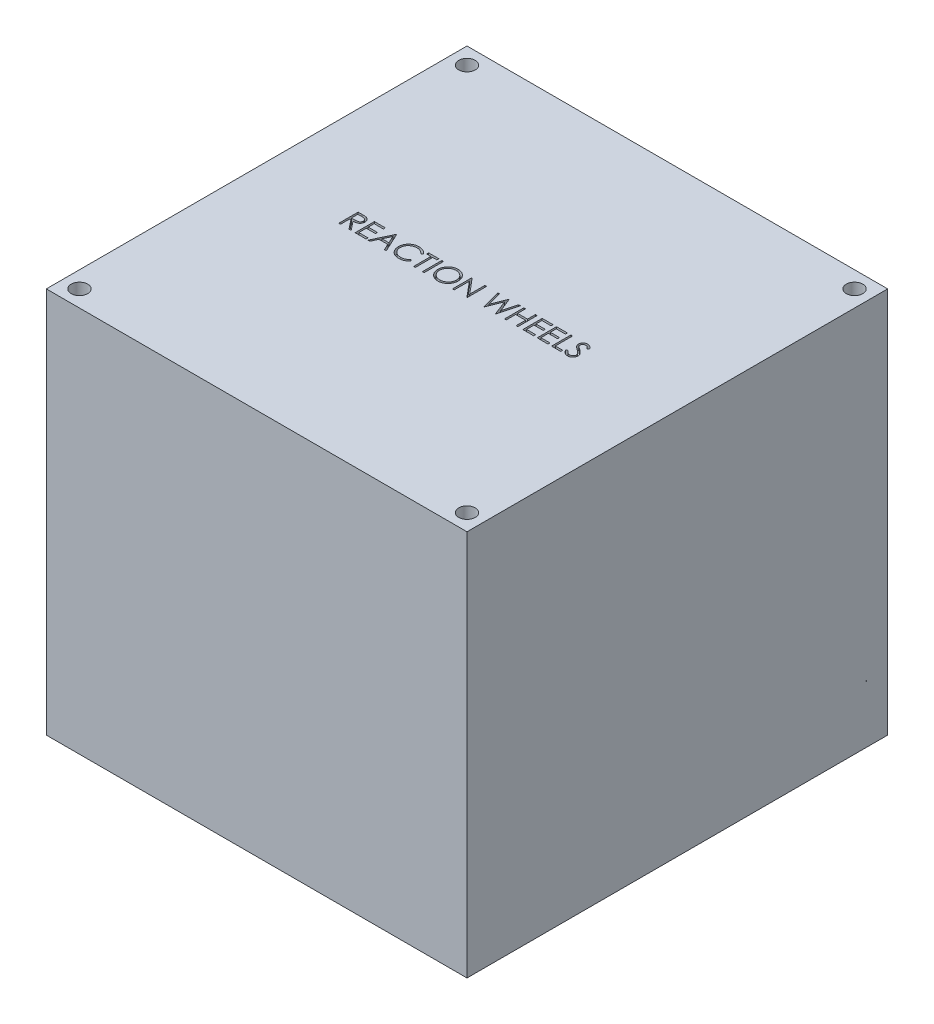
from build123d import *

# Parameters (mm, degrees)
SKETCH1_W              = 76.2
SKETCH1_H              = 76.2
BULK_DEPTH             = 70
SKETCH2_R              = 1.5
MOUNTING_HOLES_DEPTH   = 78.75
SKETCH3_W              = 0.314102564
SKETCH3_H              = 3.5
LABEL_DEPTH            = 1
SKETCH4_W              = 1.2
SKETCH4_H              = 1.2
SKETCH4_W_2            = 1
SKETCH4_H_2            = 1
ALIGNMNET_FIXING_DEPTH = 10


with BuildPart() as part:
    # Sketch1 → Bulk (new body)
    with BuildSketch(Plane(origin=(0, 0, 0), x_dir=(1, 0, 0), z_dir=(0, 1, 0))):
        Rectangle(SKETCH1_W, SKETCH1_H)
    extrude(amount=BULK_DEPTH)

    # Sketch2 → Mounting Holes (cut)
    with BuildSketch(Plane(origin=(0, 70, 0), x_dir=(1, 0, 0), z_dir=(0, 1, 0))):
        with Locations(Location((-35.1, 35.1, 0), (0, 0, 270))):
            Circle(SKETCH2_R)
        with Locations(Location((35.1, 35.1, 0), (0, 0, 270))):
            Circle(SKETCH2_R)
        with Locations(Location((35.1, -35.1, 0), (0, 0, 270))):
            Circle(SKETCH2_R)
        with Locations(Location((-35.1, -35.1, 0), (0, 0, 270))):
            Circle(SKETCH2_R)
    extrude(amount=-MOUNTING_HOLES_DEPTH, mode=Mode.SUBTRACT)

    # Sketch3 → Label (cut)
    # profile 1 of 14: a face of its own
    with BuildSketch(Plane(origin=(0, 70, 0), x_dir=(1, 0, 0), z_dir=(0, 1, 0))):
        with BuildLine():
            Line((-21.906366379, 2.178643643), (-21.205945706, 2.178643643))
            add(Edge.make_bspline(
                [(-21.205945706, 2.178643643), (-21.159204577, 2.178488057), (-21.069456433, 2.178189315), (-20.940883163, 2.176523552), (-20.824056066, 2.171749196), (-20.719036226, 2.167640612), (-20.625825571, 2.160148671), (-20.544138281, 2.152988024), (-20.474350583, 2.143614363), (-20.432104732, 2.13490894), (-20.412976956, 2.130967361)],
                knots=[0, 0, 0, 0, 1.410062039, 2.707475311, 3.878576406, 4.937260626, 5.877586885, 6.699081471, 7.410979367, 8, 8, 8, 8], degree=3))
            add(Edge.make_bspline(
                [(-20.412976956, 2.130967361), (-20.387370332, 2.124640595), (-20.336703342, 2.112122032), (-20.263753276, 2.085662431), (-20.194238952, 2.055042806), (-20.128449128, 2.019079086), (-20.066713337, 1.977504306), (-20.008395026, 1.931036184), (-19.953229563, 1.879928978), (-19.903447932, 1.822894137), (-19.856508881, 1.763057627), (-19.816920254, 1.69835387), (-19.782793774, 1.630692343), (-19.755623257, 1.559384925), (-19.733745284, 1.485123153), (-19.718319045, 1.407234356), (-19.709067857, 1.326073381), (-19.708126001, 1.270715472), (-19.70764843, 1.242646047)],
                knots=[0, 0, 0, 0, 1.027469482, 2.033020251, 3.019912614, 3.986113645, 4.951240523, 5.91722682, 6.890402269, 7.87763091, 8.8651537, 9.85103654, 10.82876324, 11.815024772, 12.821070561, 13.842952187, 14.906261191, 16, 16, 16, 16], degree=3))
            add(Edge.make_bspline(
                [(-19.70764843, 1.242646047), (-19.709117428, 1.196010942), (-19.711983824, 1.105013774), (-19.738708928, 0.972952893), (-19.782485448, 0.849763578), (-19.842808737, 0.73560094), (-19.919628212, 0.632690295), (-20.011953003, 0.54229984), (-20.119834615, 0.466659927), (-20.220263931, 0.414207122), (-20.30897813, 0.380614214), (-20.382011443, 0.356977855), (-20.461678421, 0.33871589), (-20.547215755, 0.322355758), (-20.638979411, 0.310004063), (-20.73674945, 0.300957469), (-20.840595602, 0.29530342), (-20.911934671, 0.294461415), (-20.948634007, 0.294028258)],
                knots=[0, 0, 0, 0, 1.260483769, 2.459530307, 3.627416485, 4.787058657, 5.939039949, 7.08810263, 8.267026773, 9.491475466, 10.141966685, 10.831826277, 11.566392101, 12.351337768, 13.187381173, 14.07005841, 15.007169909, 16, 16, 16, 16], degree=3))
            Line((-20.948634007, 0.294028258), (-19.662776635, -1.321356357))
            Line((-19.662776635, -1.321356357), (-20.05119811, -1.321356357))
            Line((-20.05119811, -1.321356357), (-21.337055481, 0.294028258))
            Line((-21.337055481, 0.294028258), (-21.592263815, 0.294028258))
            Line((-21.592263815, 0.294028258), (-21.592263815, -1.321356357))
            Line((-21.592263815, -1.321356357), (-21.906366379, -1.321356357))
            Line((-21.906366379, -1.321356357), (-21.906366379, 2.178643643))
        make_face()
        with BuildLine():
            Line((-21.592263815, 1.819669284), (-21.592263815, 0.653002617))
            Line((-21.592263815, 0.653002617), (-20.951438494, 0.648094765))
            add(Edge.make_bspline(
                [(-20.951438494, 0.648094765), (-20.921518455, 0.648081528), (-20.863524898, 0.648055872), (-20.779624233, 0.652049648), (-20.701504122, 0.656592966), (-20.62946337, 0.663542312), (-20.563469794, 0.672498383), (-20.503556381, 0.683701368), (-20.449625329, 0.69675343), (-20.386726791, 0.716955056), (-20.316490259, 0.748961074), (-20.2401588, 0.795526573), (-20.175156462, 0.854095692), (-20.120238599, 0.921069148), (-20.076109168, 0.994705397), (-20.044997114, 1.074121766), (-20.025254671, 1.157313364), (-20.022926126, 1.214491472), (-20.021750994, 1.243347169)],
                knots=[0, 0, 0, 0, 1.146690395, 2.22261258, 3.21895312, 4.145990853, 4.996080663, 5.770904154, 6.481378293, 7.121626537, 8.300444488, 9.431385265, 10.535395872, 11.636531494, 12.74115979, 13.810798291, 14.895190096, 16, 16, 16, 16], degree=3))
            add(Edge.make_bspline(
                [(-20.021750994, 1.243347169), (-20.022953115, 1.271493742), (-20.025335281, 1.327269981), (-20.044784049, 1.408925891), (-20.077673431, 1.485992841), (-20.121995669, 1.558157326), (-20.175994824, 1.623663062), (-20.239312636, 1.679710215), (-20.310217831, 1.72595968), (-20.37648903, 1.75551406), (-20.435723242, 1.773633914), (-20.487152902, 1.786385078), (-20.54526438, 1.796629546), (-20.610339839, 1.804837607), (-20.682101469, 1.811892552), (-20.76091212, 1.81664433), (-20.846248901, 1.819458194), (-20.905395832, 1.819597283), (-20.936013815, 1.819669284)],
                knots=[0, 0, 0, 0, 1.101028733, 2.181837193, 3.264309656, 4.369019818, 5.486613113, 6.575447106, 7.666700264, 8.788928104, 9.402425223, 10.0903467, 10.862060571, 11.710948788, 12.657782767, 13.684531032, 14.801375019, 16, 16, 16, 16], degree=3))
            Line((-20.936013815, 1.819669284), (-21.592263815, 1.819669284))
        make_face(mode=Mode.SUBTRACT)
    # profile 2 of 14: a face of its own
    with BuildSketch(Plane(origin=(0, 70, 0), x_dir=(1, 0, 0), z_dir=(0, 1, 0))):
        Polygon((-18.944827917, 2.178643643), (-16.970468943, 2.178643643), (-16.970468943, 1.819669284), (-18.630725353, 1.819669284), (-18.630725353, 0.742746207), (-16.970468943, 0.742746207), (-16.970468943, 0.383771848), (-18.630725353, 0.383771848), (-18.630725353, -0.962381998), (-16.970468943, -0.962381998), (-16.970468943, -1.321356357), (-18.944827917, -1.321356357), align=None)
    # profile 3 of 14: a face of its own
    with BuildSketch(Plane(origin=(0, 70, 0), x_dir=(1, 0, 0), z_dir=(0, 1, 0))):
        Polygon((-14.906366379, 2.178643643), (-13.290981764, -1.321356357), (-13.632428078, -1.321356357), (-14.149855962, -0.199561485), (-15.736494584, -0.199561485), (-16.268646026, -1.321356357), (-16.611494584, -1.321356357), (-14.951238174, 2.178643643), align=None)
        Polygon((-14.932307885, 1.496452136), (-15.566121988, 0.159412874), (-14.315320706, 0.159412874), align=None, mode=Mode.SUBTRACT)
    # profile 4 of 14: a face of its own
    with BuildSketch(Plane(origin=(0, 70, 0), x_dir=(1, 0, 0), z_dir=(0, 1, 0))):
        with BuildLine():
            Line((-9.432007405, 1.536416079), (-9.706847148, 1.32607954))
            add(Edge.make_bspline(
                [(-9.706847148, 1.32607954), (-9.726453037, 1.34944551), (-9.765400483, 1.395862426), (-9.828059686, 1.46104197), (-9.893361329, 1.522107232), (-9.96128045, 1.579349111), (-10.033039569, 1.630765877), (-10.106900368, 1.67903698), (-10.184098413, 1.722304718), (-10.290850148, 1.774767704), (-10.430497996, 1.829513859), (-10.606292835, 1.87541709), (-10.789803934, 1.904638266), (-10.915001533, 1.907803108), (-10.978682084, 1.909412874)],
                knots=[0, 0, 0, 0, 0.757959112, 1.505699292, 2.245454638, 2.979532153, 3.711538275, 4.438200793, 5.171680507, 5.909471876, 7.393775596, 8.890124382, 10.418191784, 12, 12, 12, 12], degree=3))
            add(Edge.make_bspline(
                [(-10.978682084, 1.909412874), (-11.013765383, 1.909008911), (-11.083606376, 1.908204735), (-11.187254849, 1.89759561), (-11.288967901, 1.8826844), (-11.388679367, 1.860559077), (-11.486262325, 1.832586458), (-11.582354727, 1.799161044), (-11.675565327, 1.757806204), (-11.767183565, 1.712097944), (-11.854962776, 1.660470499), (-11.938017824, 1.604157147), (-12.016045792, 1.543788051), (-12.089108404, 1.479136945), (-12.157280353, 1.410494984), (-12.220067663, 1.337130642), (-12.277253074, 1.259278469), (-12.329970099, 1.177965061), (-12.377182832, 1.09342727), (-12.416712711, 1.005352199), (-12.451717834, 0.915248096), (-12.479417076, 0.822096935), (-12.501341593, 0.72655417), (-12.516469256, 0.628363382), (-12.526957728, 0.527729702), (-12.527757905, 0.459520389), (-12.528161251, 0.425138034)],
                knots=[0, 0, 0, 0, 1.054917814, 2.100044995, 3.131103042, 4.146048494, 5.169673617, 6.183595914, 7.203665975, 8.234915748, 9.262203917, 10.264457458, 11.251630812, 12.227803204, 13.197192746, 14.159520551, 15.12972552, 16.100847026, 17.073214652, 18.039054194, 19.002613845, 19.979014051, 20.95965708, 21.949030935, 22.966165397, 24, 24, 24, 24], degree=3))
            add(Edge.make_bspline(
                [(-12.528161251, 0.425138034), (-12.526899432, 0.373406714), (-12.524422017, 0.271839129), (-12.502373683, 0.123068519), (-12.468868592, -0.019452155), (-12.418653015, -0.154831997), (-12.356733965, -0.284740356), (-12.278493353, -0.406979209), (-12.187876816, -0.523395773), (-12.083602396, -0.631238721), (-11.96919658, -0.729752447), (-11.846448669, -0.816503028), (-11.715664381, -0.88881791), (-11.578287751, -0.948993857), (-11.433261637, -0.995250585), (-11.280846834, -1.027814708), (-11.121374839, -1.049056889), (-11.012405439, -1.051090577), (-10.956947308, -1.052125588)],
                knots=[0, 0, 0, 0, 1.029171465, 2.020641659, 2.987623507, 3.938342917, 4.889210282, 5.84687017, 6.821220943, 7.821438502, 8.827599549, 9.822697543, 10.807740252, 11.797342354, 12.80366471, 13.83203677, 14.896651826, 16, 16, 16, 16], degree=3))
            add(Edge.make_bspline(
                [(-10.956947308, -1.052125588), (-10.895844619, -1.050436808), (-10.77557991, -1.047112886), (-10.599211884, -1.018953636), (-10.430376119, -0.973295719), (-10.269063532, -0.909397796), (-10.115728886, -0.826332508), (-9.970132225, -0.725634631), (-9.832150655, -0.606346298), (-9.749179373, -0.51526317), (-9.706847148, -0.468792255)],
                knots=[0, 0, 0, 0, 1.028121516, 2.023589091, 2.998037872, 3.967518031, 4.937445131, 5.927275754, 6.942489185, 8, 8, 8, 8], degree=3))
            Line((-9.706847148, -0.468792255), (-9.432007405, -0.677025428))
            add(Edge.make_bspline(
                [(-9.432007405, -0.677025428), (-9.454125514, -0.70556388), (-9.49825579, -0.762504086), (-9.569713807, -0.842775796), (-9.644991104, -0.918279831), (-9.724646814, -0.988407452), (-9.807764606, -1.054561918), (-9.895836918, -1.114863749), (-9.987705951, -1.170154633), (-10.083060429, -1.220781558), (-10.181799042, -1.265698805), (-10.283803477, -1.304152573), (-10.388634053, -1.337277462), (-10.496295561, -1.364529399), (-10.607011318, -1.385800483), (-10.720381792, -1.400020158), (-10.836651667, -1.409762072), (-10.915093088, -1.410649988), (-10.954843943, -1.411099947)],
                knots=[0, 0, 0, 0, 0.986787822, 1.968848986, 2.935600012, 3.899624008, 4.868462664, 5.837806735, 6.815139263, 7.798259679, 8.787526145, 9.778297419, 10.776456485, 11.791383307, 12.812564526, 13.85620153, 14.913611965, 16, 16, 16, 16], degree=3))
            add(Edge.make_bspline(
                [(-10.954843943, -1.411099947), (-10.99248761, -1.410837954), (-11.0669233, -1.410319896), (-11.176822052, -1.401927729), (-11.283811633, -1.390477992), (-11.387586258, -1.373237861), (-11.488712234, -1.352893521), (-11.586272818, -1.325622264), (-11.681228028, -1.295073098), (-11.773196369, -1.259168111), (-11.862256069, -1.218651929), (-11.94811988, -1.17286037), (-12.030748313, -1.122178505), (-12.110953733, -1.067723495), (-12.187551317, -1.007746193), (-12.261204842, -0.943079558), (-12.332327319, -0.873941547), (-12.376330004, -0.824086694), (-12.398453719, -0.79902062)],
                knots=[0, 0, 0, 0, 1.114604814, 2.203992996, 3.262667896, 4.300477797, 5.318619304, 6.316056647, 7.298880507, 8.271930387, 9.238335007, 10.195173496, 11.151986948, 12.108099108, 13.064862484, 14.031167946, 15.010108607, 16, 16, 16, 16], degree=3))
            add(Edge.make_bspline(
                [(-12.398453719, -0.79902062), (-12.433889362, -0.755479431), (-12.504332839, -0.668922721), (-12.594458523, -0.528636739), (-12.671606078, -0.38216853), (-12.733981999, -0.228748602), (-12.782744732, -0.068721214), (-12.816525927, 0.0979943), (-12.838477531, 0.271242242), (-12.84098782, 0.389079031), (-12.842263815, 0.448976175)],
                knots=[0, 0, 0, 0, 0.994628077, 1.977248131, 2.950237994, 3.925870899, 4.908910175, 5.911660606, 6.938484602, 8, 8, 8, 8], degree=3))
            add(Edge.make_bspline(
                [(-12.842263815, 0.448976175), (-12.840708621, 0.511931628), (-12.837648875, 0.635792553), (-12.81165308, 0.817566506), (-12.769834283, 0.991717905), (-12.710437395, 1.15792165), (-12.635132043, 1.31705193), (-12.54210543, 1.467893135), (-12.432438287, 1.611409935), (-12.30699072, 1.745424686), (-12.169423384, 1.867964038), (-12.022104571, 1.975770242), (-11.865322624, 2.065487758), (-11.700804772, 2.140483921), (-11.52731909, 2.198128384), (-11.345235721, 2.23848157), (-11.154896806, 2.263598687), (-11.025034381, 2.266773895), (-10.959050674, 2.268387233)],
                knots=[0, 0, 0, 0, 1.032925535, 2.032216505, 3.007276963, 3.968222605, 4.92396291, 5.891752235, 6.871517503, 7.883894988, 8.900124299, 9.891468569, 10.874487609, 11.85992873, 12.854644235, 13.869047385, 14.917252991, 16, 16, 16, 16], degree=3))
            add(Edge.make_bspline(
                [(-10.959050674, 2.268387233), (-10.918836202, 2.267905094), (-10.839235705, 2.26695075), (-10.721483052, 2.257644608), (-10.606840725, 2.242131002), (-10.495229743, 2.221014932), (-10.386107127, 2.194807611), (-10.280306886, 2.160667313), (-10.177208199, 2.121630781), (-10.077461291, 2.076672315), (-9.981544741, 2.026205574), (-9.889488422, 1.97078995), (-9.802023564, 1.910494145), (-9.718534715, 1.845830969), (-9.640418504, 1.77543241), (-9.565457026, 1.701234814), (-9.496195947, 1.62110099), (-9.453442752, 1.564696056), (-9.432007405, 1.536416079)],
                knots=[0, 0, 0, 0, 1.096760587, 2.17092713, 3.219439832, 4.250915756, 5.268269357, 6.278326846, 7.281116186, 8.274029601, 9.260640565, 10.235837813, 11.203064059, 12.156899882, 13.114053108, 14.069676657, 15.032185724, 16, 16, 16, 16], degree=3))
        make_face()
    # profile 5 of 14: a face of its own
    with BuildSketch(Plane(origin=(0, 70, 0), x_dir=(1, 0, 0), z_dir=(0, 1, 0))):
        Polygon((-9.11790484, 1.819669284), (-9.11790484, 2.178643643), (-7.278161251, 2.178643643), (-7.278161251, 1.819669284), (-8.040981764, 1.819669284), (-8.040981764, -1.321356357), (-8.355084328, -1.321356357), (-8.355084328, 1.819669284), align=None)
    # profile 6 of 14: a face of its own
    with BuildSketch(Plane(origin=(0, 70, 0), x_dir=(1, 0, 0), z_dir=(0, 1, 0))):
        with Locations((-6.58264843, 0.428643643)):
            Rectangle(SKETCH3_W, SKETCH3_H)
    # profile 7 of 14: a face of its own
    with BuildSketch(Plane(origin=(0, 70, 0), x_dir=(1, 0, 0), z_dir=(0, 1, 0))):
        with BuildLine():
            add(Edge.make_bspline(
                [(-3.890340738, 2.268387233), (-3.825532632, 2.266745753), (-3.698244165, 2.263521752), (-3.511169267, 2.238842649), (-3.332574172, 2.196147259), (-3.161004033, 2.139284276), (-2.998511057, 2.063429891), (-2.843872164, 1.971744743), (-2.69745529, 1.863268284), (-2.561233909, 1.738839057), (-2.436576959, 1.603455603), (-2.326751072, 1.458977693), (-2.234708779, 1.306278891), (-2.159122991, 1.14581806), (-2.099824382, 0.977958092), (-2.058905338, 0.801804089), (-2.032767188, 0.618497399), (-2.02971141, 0.493470535), (-2.028161251, 0.430045886)],
                knots=[0, 0, 0, 0, 1.065120563, 2.091984664, 3.0946048, 4.079830382, 5.057816894, 6.036188127, 7.030412546, 8.04752943, 9.064399622, 10.05169764, 11.02544977, 11.989514704, 12.962713494, 13.945757189, 14.957906945, 16, 16, 16, 16], degree=3))
            add(Edge.make_bspline(
                [(-2.028161251, 0.430045886), (-2.029711183, 0.36708844), (-2.03276628, 0.24299202), (-2.058935057, 0.060848576), (-2.099976057, -0.114242121), (-2.158572324, -0.281987774), (-2.233797802, -0.442565338), (-2.326452973, -0.595552291), (-2.435594184, -0.74099879), (-2.559801035, -0.877311455), (-2.695202077, -1.002308926), (-2.840432344, -1.111227801), (-2.992225664, -1.204951926), (-3.152535372, -1.2797356), (-3.319235409, -1.33950752), (-3.493817732, -1.38026015), (-3.675464286, -1.406547194), (-3.79933529, -1.40956571), (-3.862295866, -1.411099947)],
                knots=[0, 0, 0, 0, 1.043624062, 2.057103931, 3.04512605, 4.022047818, 4.998200453, 5.980619268, 6.982898556, 8.009068085, 9.034988726, 10.034168286, 11.015286542, 11.987931943, 12.962482838, 13.94673481, 14.956375938, 16, 16, 16, 16], degree=3))
            add(Edge.make_bspline(
                [(-3.862295866, -1.411099947), (-3.925720185, -1.40955056), (-4.050746401, -1.406496306), (-4.234283436, -1.380314901), (-4.41056118, -1.339373597), (-4.579075531, -1.280864161), (-4.739920461, -1.205246931), (-4.893410544, -1.113042551), (-5.038929691, -1.00363541), (-5.175271437, -0.879468836), (-5.300020636, -0.744297284), (-5.408780011, -0.599463029), (-5.501005125, -0.447807572), (-5.576368457, -0.288910048), (-5.636032917, -0.123538605), (-5.676737735, 0.049409872), (-5.703073687, 0.228949378), (-5.706108533, 0.351192276), (-5.70764843, 0.413218963)],
                knots=[0, 0, 0, 0, 1.053102029, 2.075944431, 3.073151272, 4.055350789, 5.033113405, 6.020478099, 7.024410459, 8.052272461, 9.079885166, 10.07527673, 11.055994387, 12.023226415, 12.992069828, 13.970394897, 14.97016774, 16, 16, 16, 16], degree=3))
            add(Edge.make_bspline(
                [(-5.70764843, 0.413218963), (-5.707113795, 0.454851633), (-5.706051268, 0.537591756), (-5.693259576, 0.660458356), (-5.674697875, 0.781349014), (-5.648095962, 0.899919962), (-5.613304295, 1.015880947), (-5.572252268, 1.130031709), (-5.522112422, 1.241215433), (-5.465431774, 1.349958825), (-5.402169966, 1.454566731), (-5.332294217, 1.553446314), (-5.258258848, 1.647427311), (-5.177095455, 1.734074315), (-5.09147901, 1.815907971), (-5.000020631, 1.891670688), (-4.903278387, 1.962045639), (-4.800836007, 2.02546598), (-4.695217732, 2.082825115), (-4.586340955, 2.132046966), (-4.475684383, 2.174293027), (-4.362729735, 2.208533852), (-4.247776963, 2.235565888), (-4.130575179, 2.253973242), (-4.011217752, 2.26679756), (-3.930806433, 2.267855062), (-3.890340738, 2.268387233)],
                knots=[0, 0, 0, 0, 1.037015668, 2.060948919, 3.074880161, 4.083647147, 5.086022904, 6.090072063, 7.104153813, 8.122640571, 9.144368836, 10.147691507, 11.138137339, 12.123020368, 13.103399296, 14.087645067, 15.080126199, 16.082011238, 17.087798457, 18.072939717, 19.057185487, 20.037253025, 21.01195951, 21.997135196, 22.992090687, 24, 24, 24, 24], degree=3))
        make_face()
        with BuildLine():
            add(Edge.make_bspline(
                [(-3.874916058, 1.909412874), (-3.908130692, 1.909007983), (-3.974242425, 1.908202074), (-4.072526961, 1.897586358), (-4.169518895, 1.882456469), (-4.265238257, 1.860874948), (-4.359284547, 1.831470896), (-4.452534388, 1.797629987), (-4.544137442, 1.756408897), (-4.633791299, 1.709836192), (-4.720706375, 1.658287272), (-4.802719076, 1.601315505), (-4.88004172, 1.54025695), (-4.952484987, 1.474969113), (-5.019836159, 1.405119511), (-5.08342086, 1.331767075), (-5.140690442, 1.252815184), (-5.193176019, 1.170404777), (-5.240143859, 1.084643196), (-5.281909214, 0.996433334), (-5.316073223, 0.905055647), (-5.343935599, 0.811501489), (-5.36703541, 0.71591903), (-5.381669334, 0.617583181), (-5.392401693, 0.516988069), (-5.393161539, 0.449006215), (-5.393545866, 0.414621207)],
                knots=[0, 0, 0, 0, 1.008559885, 2.007477868, 2.99961109, 3.989939068, 4.984837346, 5.991145699, 7.001802488, 8.033829008, 9.059044045, 10.069351652, 11.065060232, 12.050310815, 13.029377138, 14.011219647, 14.996725999, 15.989392538, 16.977580475, 17.965360261, 18.951710183, 19.937753436, 20.929683414, 21.935841486, 22.955955122, 24, 24, 24, 24], degree=3))
            add(Edge.make_bspline(
                [(-5.393545866, 0.414621207), (-5.392271004, 0.364058986), (-5.389762956, 0.264587456), (-5.367805386, 0.118819312), (-5.333983412, -0.021268974), (-5.284126045, -0.154910884), (-5.221775431, -0.283255166), (-5.14474854, -0.405163271), (-5.053489455, -0.520668145), (-4.949825928, -0.628963414), (-4.836503222, -0.727809219), (-4.716170492, -0.814572627), (-4.590116884, -0.887982877), (-4.458013681, -0.94778795), (-4.320566142, -0.995177687), (-4.176888591, -1.027656318), (-4.027938132, -1.049031774), (-3.926407477, -1.05108453), (-3.874916058, -1.052125588)],
                knots=[0, 0, 0, 0, 1.032063989, 2.030389145, 3.003944642, 3.970395727, 4.937377036, 5.913328081, 6.909231446, 7.93887556, 8.970685674, 9.976071282, 10.964166581, 11.944589148, 12.933237628, 13.927779006, 14.949070134, 16, 16, 16, 16], degree=3))
            add(Edge.make_bspline(
                [(-3.874916058, -1.052125588), (-3.840306557, -1.051650084), (-3.77166552, -1.050707016), (-3.669569998, -1.041208339), (-3.569313786, -1.025976469), (-3.471037506, -1.004045814), (-3.374852695, -0.976598607), (-3.280357892, -0.943990879), (-3.188559602, -0.903309676), (-3.098299764, -0.858361724), (-3.011903522, -0.807121567), (-2.92942799, -0.752083417), (-2.85295201, -0.691114796), (-2.780562939, -0.626796984), (-2.71293525, -0.557833136), (-2.650526265, -0.484312914), (-2.593546133, -0.405772257), (-2.541080487, -0.323486851), (-2.494277224, -0.237490598), (-2.453498125, -0.14896092), (-2.418902009, -0.058115811), (-2.390973504, 0.035175761), (-2.369088042, 0.130736609), (-2.354008123, 0.228694688), (-2.343459684, 0.32885403), (-2.342664607, 0.396597886), (-2.342263815, 0.430747008)],
                knots=[0, 0, 0, 0, 1.047197238, 2.076906641, 3.100256066, 4.114471768, 5.12198147, 6.126382909, 7.136867548, 8.15857795, 9.17633901, 10.174870724, 11.156907918, 12.133735059, 13.104061851, 14.077631395, 15.04955518, 16.038496417, 17.029181396, 18.010275684, 18.986308667, 19.968651475, 20.955262928, 21.950658345, 22.966943676, 24, 24, 24, 24], degree=3))
            add(Edge.make_bspline(
                [(-2.342263815, 0.430747008), (-2.342664928, 0.464662513), (-2.343460609, 0.531940163), (-2.354003084, 0.631400981), (-2.369103974, 0.728654193), (-2.390866682, 0.823317996), (-2.418916836, 0.915416521), (-2.453504166, 1.004863268), (-2.494289466, 1.091991463), (-2.54109769, 1.17658576), (-2.593713514, 1.257760498), (-2.651207757, 1.335362911), (-2.714573105, 1.407935652), (-2.78199913, 1.477270346), (-2.855170015, 1.541888236), (-2.93375431, 1.601810757), (-3.016797987, 1.658484031), (-3.104725223, 1.709609593), (-3.195469176, 1.756823825), (-3.288583134, 1.797274829), (-3.383012234, 1.831646948), (-3.478516346, 1.860963913), (-3.575899325, 1.882371943), (-3.674503154, 1.897599993), (-3.774191412, 1.908198379), (-3.841234632, 1.909006757), (-3.874916058, 1.909412874)],
                knots=[0, 0, 0, 0, 1.02996197, 2.043119294, 3.035359645, 4.018872909, 4.991431989, 5.957985074, 6.929999688, 7.912076566, 8.892894881, 9.867085534, 10.843653904, 11.817741046, 12.803660682, 13.806313499, 14.818574707, 15.856120519, 16.894564902, 17.924820532, 18.937903209, 19.946497019, 20.957711757, 21.963978472, 22.977135795, 24, 24, 24, 24], degree=3))
        make_face(mode=Mode.SUBTRACT)
    # profile 8 of 14: a face of its own
    with BuildSketch(Plane(origin=(0, 70, 0), x_dir=(1, 0, 0), z_dir=(0, 1, 0))):
        Polygon((-1.310212533, -1.321356357), (-1.310212533, 2.178643643), (-1.244307084, 2.178643643), (1.067992595, -0.576063889), (1.067992595, 2.178643643), (1.38209516, 2.178643643), (1.38209516, -1.321356357), (1.310580736, -1.321356357), (-0.996109969, 1.427041079), (-0.996109969, -1.321356357), align=None)
    # profile 9 of 14: a face of its own
    with BuildSketch(Plane(origin=(0, 70, 0), x_dir=(1, 0, 0), z_dir=(0, 1, 0))):
        Polygon((3.401325929, 2.178643643), (3.72594532, 2.178643643), (4.410941313, -0.388163248), (5.429671281, 2.178643643), (5.475244198, 2.178643643), (6.475043877, -0.370635203), (7.16354548, 2.178643643), (7.484659262, 2.178643643), (6.540949326, -1.321356357), (6.496077531, -1.321356357), (5.442992595, 1.355526656), (4.377287467, -1.321356357), (4.332415672, -1.321356357), align=None)
    # profile 10 of 14: a face of its own
    with BuildSketch(Plane(origin=(0, 70, 0), x_dir=(1, 0, 0), z_dir=(0, 1, 0))):
        Polygon((8.11286439, 2.178643643), (8.426966954, 2.178643643), (8.426966954, 0.742746207), (10.221838749, 0.742746207), (10.221838749, 2.178643643), (10.535941313, 2.178643643), (10.535941313, -1.321356357), (10.221838749, -1.321356357), (10.221838749, 0.383771848), (8.426966954, 0.383771848), (8.426966954, -1.321356357), (8.11286439, -1.321356357), align=None)
    # profile 11 of 14: a face of its own
    with BuildSketch(Plane(origin=(0, 70, 0), x_dir=(1, 0, 0), z_dir=(0, 1, 0))):
        Polygon((11.433377211, 2.178643643), (13.407736185, 2.178643643), (13.407736185, 1.819669284), (11.747479775, 1.819669284), (11.747479775, 0.742746207), (13.407736185, 0.742746207), (13.407736185, 0.383771848), (11.747479775, 0.383771848), (11.747479775, -0.962381998), (13.407736185, -0.962381998), (13.407736185, -1.321356357), (11.433377211, -1.321356357), align=None)
    # profile 12 of 14: a face of its own
    with BuildSketch(Plane(origin=(0, 70, 0), x_dir=(1, 0, 0), z_dir=(0, 1, 0))):
        Polygon((14.035941313, 2.178643643), (16.010300288, 2.178643643), (16.010300288, 1.819669284), (14.350043877, 1.819669284), (14.350043877, 0.742746207), (16.010300288, 0.742746207), (16.010300288, 0.383771848), (14.350043877, 0.383771848), (14.350043877, -0.962381998), (16.010300288, -0.962381998), (16.010300288, -1.321356357), (14.035941313, -1.321356357), align=None)
    # profile 13 of 14: a face of its own
    with BuildSketch(Plane(origin=(0, 70, 0), x_dir=(1, 0, 0), z_dir=(0, 1, 0))):
        Polygon((16.638505416, 2.178643643), (16.95260798, 2.178643643), (16.95260798, -0.962381998), (18.298761826, -0.962381998), (18.298761826, -1.321356357), (16.638505416, -1.321356357), align=None)
    # profile 14 of 14: a face of its own
    with BuildSketch(Plane(origin=(0, 70, 0), x_dir=(1, 0, 0), z_dir=(0, 1, 0))):
        with BuildLine():
            Line((18.523120801, -0.646176069), (18.818994198, -0.468792255))
            add(Edge.make_bspline(
                [(18.818994198, -0.468792255), (18.846512435, -0.514856639), (18.899236316, -0.603114223), (18.987187675, -0.722372264), (19.078320586, -0.823734421), (19.17330992, -0.906611028), (19.271575868, -0.971859915), (19.373759922, -1.018062147), (19.479517732, -1.046878122), (19.551491554, -1.050378209), (19.587423685, -1.052125588)],
                knots=[0, 0, 0, 0, 1.272034388, 2.437168799, 3.508375237, 4.49857839, 5.41946034, 6.295179144, 7.148887113, 8, 8, 8, 8], degree=3))
            add(Edge.make_bspline(
                [(19.587423685, -1.052125588), (19.618110546, -1.051270915), (19.678947319, -1.049576525), (19.768509562, -1.033295723), (19.855491364, -1.008283594), (19.938100002, -0.972462663), (20.015195616, -0.929124177), (20.082802312, -0.876777999), (20.141248425, -0.818171794), (20.189057539, -0.752789139), (20.225737575, -0.68247199), (20.253929643, -0.610296039), (20.269574717, -0.535127471), (20.27193147, -0.484517008), (20.273120801, -0.458976549)],
                knots=[0, 0, 0, 0, 1.095163259, 2.171163733, 3.241058638, 4.321873601, 5.38011039, 6.391990106, 7.366004449, 8.327778327, 9.272591725, 10.192022065, 11.087607919, 12, 12, 12, 12], degree=3))
            add(Edge.make_bspline(
                [(20.273120801, -0.458976549), (20.27164649, -0.4298357), (20.268649432, -0.370596611), (20.243317952, -0.283196958), (20.203468705, -0.196704388), (20.166706061, -0.143203122), (20.147619999, -0.11542687)],
                knots=[0, 0, 0, 0, 0.938893495, 1.908633276, 2.914225137, 4, 4, 4, 4], degree=3))
            add(Edge.make_bspline(
                [(20.147619999, -0.11542687), (20.131949385, -0.095380046), (20.099050891, -0.053294248), (20.042493378, 0.009350988), (19.976127264, 0.073969407), (19.902223709, 0.143028464), (19.81809062, 0.21331626), (19.726363106, 0.288184538), (19.624699247, 0.364786115), (19.55339975, 0.416158681), (19.516610384, 0.442666079)],
                knots=[0, 0, 0, 0, 0.722233717, 1.516239348, 2.393582979, 3.351407094, 4.387010283, 5.505090956, 6.712668013, 8, 8, 8, 8], degree=3))
            add(Edge.make_bspline(
                [(19.516610384, 0.442666079), (19.479786388, 0.468894666), (19.409381711, 0.519041729), (19.310923129, 0.593466013), (19.222878666, 0.661509882), (19.145639649, 0.723813894), (19.079240052, 0.780386499), (19.023156641, 0.830684438), (18.978818084, 0.876067999), (18.954162504, 0.905509341), (18.943092756, 0.918727777)],
                knots=[0, 0, 0, 0, 1.452282411, 2.77665338, 3.964542531, 5.026858415, 5.96415736, 6.766646006, 7.446254459, 8, 8, 8, 8], degree=3))
            add(Edge.make_bspline(
                [(18.943092756, 0.918727777), (18.92762021, 0.939328814), (18.897191374, 0.979843518), (18.857025368, 1.043168376), (18.822886205, 1.107991641), (18.796123873, 1.174487506), (18.773587655, 1.241722435), (18.758429724, 1.31057368), (18.748938327, 1.380732299), (18.74796634, 1.4279458), (18.747479775, 1.451580342)],
                knots=[0, 0, 0, 0, 1.068054152, 2.10047183, 3.106115577, 4.101338837, 5.06977816, 6.043150881, 7.020423561, 8, 8, 8, 8], degree=3))
            add(Edge.make_bspline(
                [(18.747479775, 1.451580342), (18.748784984, 1.488610116), (18.751367504, 1.56187818), (18.773208021, 1.66890901), (18.807680915, 1.771095428), (18.855975803, 1.867425761), (18.918233156, 1.955391742), (18.99027913, 2.036005229), (19.076090616, 2.103773811), (19.17024324, 2.16298587), (19.273299612, 2.209331795), (19.381290515, 2.244292775), (19.494387587, 2.264102033), (19.570990722, 2.266944798), (19.609859583, 2.268387233)],
                knots=[0, 0, 0, 0, 1.005424448, 1.989358655, 2.955360095, 3.929531133, 4.905563448, 5.876582895, 6.856512386, 7.866279853, 8.892233794, 9.918561126, 10.94386622, 12, 12, 12, 12], degree=3))
            add(Edge.make_bspline(
                [(19.609859583, 2.268387233), (19.651103683, 2.266964681), (19.733125035, 2.26413568), (19.85377425, 2.239538149), (19.969934967, 2.198837477), (20.063378231, 2.152648819), (20.136510993, 2.106517403), (20.192283726, 2.064497579), (20.248801176, 2.01612247), (20.306519231, 1.961263224), (20.364459891, 1.899416473), (20.423483343, 1.831005784), (20.483727612, 1.756449228), (20.522483472, 1.703224728), (20.54235157, 1.675939316)],
                knots=[0, 0, 0, 0, 1.286793592, 2.559021753, 3.825965368, 5.121522368, 5.803751409, 6.523245864, 7.299691795, 8.125521123, 9.008227632, 9.944561021, 10.946284179, 12, 12, 12, 12], degree=3))
            Line((20.54235157, 1.675939316), (20.258397243, 1.460694925))
            add(Edge.make_bspline(
                [(20.258397243, 1.460694925), (20.24125131, 1.482783615), (20.208232253, 1.525321269), (20.158102766, 1.584892584), (20.110854119, 1.639309064), (20.064303719, 1.686574192), (20.020910087, 1.729276325), (19.978793045, 1.765836082), (19.938558694, 1.796611677), (19.887841783, 1.829455237), (19.824124065, 1.862011741), (19.744139529, 1.889560819), (19.660553254, 1.906115881), (19.603623622, 1.908304768), (19.574803493, 1.909412874)],
                knots=[0, 0, 0, 0, 1.181633172, 2.275549214, 3.290209073, 4.226197932, 5.078386478, 5.862611352, 6.581680152, 7.217281963, 8.414376989, 9.595101626, 10.782541182, 12, 12, 12, 12], degree=3))
            add(Edge.make_bspline(
                [(19.574803493, 1.909412874), (19.53864697, 1.908201174), (19.468922523, 1.905864524), (19.369932287, 1.880344539), (19.280838362, 1.840162679), (19.204285797, 1.783847701), (19.14054882, 1.717126708), (19.094443361, 1.640347853), (19.066693196, 1.55556545), (19.063306917, 1.496423794), (19.061582339, 1.466303899)],
                knots=[0, 0, 0, 0, 1.14458467, 2.207223713, 3.21896685, 4.227309161, 5.202851033, 6.127160689, 7.046193047, 8, 8, 8, 8], degree=3))
            add(Edge.make_bspline(
                [(19.061582339, 1.466303899), (19.061975466, 1.447552421), (19.062762362, 1.410018801), (19.073737159, 1.354567379), (19.087836488, 1.29925604), (19.11017912, 1.244333457), (19.141024424, 1.188839098), (19.1815296, 1.13181736), (19.232542912, 1.072765652), (19.271619924, 1.034358278), (19.29225141, 1.014080342)],
                knots=[0, 0, 0, 0, 0.858281714, 1.717966888, 2.583508476, 3.4729293, 4.427298488, 5.488583878, 6.674047936, 8, 8, 8, 8], degree=3))
            add(Edge.make_bspline(
                [(19.29225141, 1.014080342), (19.299912782, 1.007243316), (19.318114449, 0.991000107), (19.351390375, 0.964407827), (19.395333173, 0.931605055), (19.448795374, 0.891017738), (19.512762736, 0.843936276), (19.587242292, 0.790962664), (19.671403825, 0.730377205), (19.731125741, 0.688019664), (19.762704134, 0.66562281)],
                knots=[0, 0, 0, 0, 0.420754252, 0.999615792, 1.744751191, 2.668019286, 3.750313428, 4.999500688, 6.413464383, 8, 8, 8, 8], degree=3))
            add(Edge.make_bspline(
                [(19.762704134, 0.66562281), (19.800690047, 0.63798145), (19.874244504, 0.584457788), (19.978902083, 0.504042108), (20.073795892, 0.42539434), (20.159259095, 0.349016733), (20.236136004, 0.27548864), (20.303573724, 0.203925459), (20.362259405, 0.134839887), (20.425438623, 0.046267311), (20.489996443, -0.062513773), (20.54543795, -0.195792012), (20.580396297, -0.329588332), (20.584967813, -0.419515169), (20.587223365, -0.463884402)],
                knots=[0, 0, 0, 0, 1.163667725, 2.253281268, 3.268753668, 4.215851969, 5.092017293, 5.902905408, 6.650798638, 7.335211899, 8.59617414, 9.77448103, 10.901945474, 12, 12, 12, 12], degree=3))
            add(Edge.make_bspline(
                [(20.587223365, -0.463884402), (20.586566227, -0.495262767), (20.585264711, -0.557410151), (20.570303798, -0.648665228), (20.548384133, -0.737296097), (20.515346899, -0.82220721), (20.47502374, -0.904951972), (20.423857492, -0.983359873), (20.364549808, -1.059166271), (20.296516043, -1.130349763), (20.22207014, -1.195695959), (20.143386446, -1.25382502), (20.060336173, -1.302293344), (19.973369856, -1.341844186), (19.88246752, -1.372777703), (19.787659736, -1.395190572), (19.688790224, -1.408946283), (19.621589743, -1.410374045), (19.587423685, -1.411099947)],
                knots=[0, 0, 0, 0, 0.983748083, 1.948392443, 2.894712957, 3.844097841, 4.80183111, 5.778335162, 6.776009319, 7.81870978, 8.863265674, 9.881300176, 10.883814829, 11.87499822, 12.874611388, 13.892143829, 14.928324115, 16, 16, 16, 16], degree=3))
            add(Edge.make_bspline(
                [(19.587423685, -1.411099947), (19.560988342, -1.410588765), (19.508450582, -1.40957284), (19.4307411, -1.400591559), (19.354601511, -1.387884456), (19.280987229, -1.367710386), (19.208949817, -1.343233409), (19.138802583, -1.313095076), (19.070511529, -1.276977875), (19.003693946, -1.23568285), (18.938519772, -1.187625106), (18.875600304, -1.131651609), (18.812871118, -1.069306104), (18.752183722, -0.998895541), (18.692310577, -0.921557458), (18.634432168, -0.836568275), (18.57735045, -0.744390921), (18.541534982, -0.679525835), (18.523120801, -0.646176069)],
                knots=[0, 0, 0, 0, 0.915332311, 1.819136955, 2.706846663, 3.586547465, 4.459518054, 5.340707479, 6.227863349, 7.133153174, 8.059268498, 9.028702269, 10.047606654, 11.120612155, 12.245963614, 13.433783089, 14.680604001, 16, 16, 16, 16], degree=3))
        make_face()
    extrude(amount=-LABEL_DEPTH, mode=Mode.SUBTRACT)

    # Sketch4 → Alignmnet fixing (cut)
    with BuildSketch(Plane.XZ):
        Rectangle(SKETCH4_W, SKETCH4_H)
        Rectangle(SKETCH4_W_2, SKETCH4_H_2, mode=Mode.SUBTRACT)
    extrude(amount=-ALIGNMNET_FIXING_DEPTH, mode=Mode.SUBTRACT)


solid = part.part
